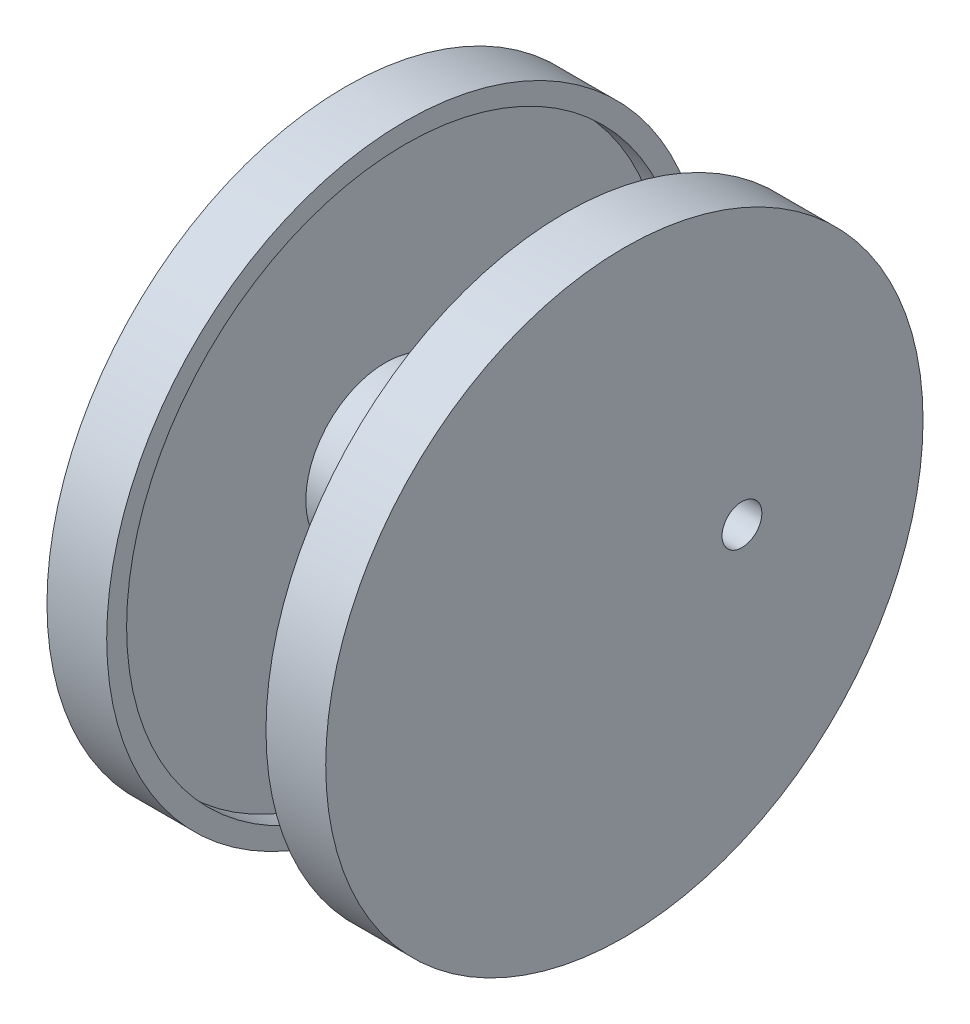
from build123d import *

# Parameters (mm, degrees)
CUT_EXTRUDE1_DEPTH = 5
CIRPATTERN1_COUNT  = 5
SKETCH4_R          = 5
CUT_EXTRUDE4_DEPTH = 16


with BuildPart() as part:
    # Sketch1 → Revolve2 (revolve)
    with BuildSketch(Plane.XY, mode=Mode.PRIVATE) as revolve2_sk:
        Polygon((-52.115384615, 0), (17.884615385, 0), (17.884615385, 75), (2.884615385, 75), (2.884615385, 70), (7.884615385, 70), (7.884615385, 20), (-42.115384615, 20), (-42.115384615, 70), (-37.115384615, 70), (-37.115384615, 75), (-52.115384615, 75), align=None)
    revolve(revolve2_sk.sketch.rotate(Axis((-114.1965821, 0, 0), (1, 0, 0)), 90), axis=Axis((-114.1965821, 0, 0), (1, 0, 0)))

    # Sketch2 → Cut-Extrude1 (cut)
    with BuildSketch(Plane.ZY.offset(52.115384615)):
        with BuildLine():
            Line((-18.889553649, 71.548478411), (-17.514771122, 65.705652668))
            ThreePointArc((-17.514771122, 65.705652668), (0, 68), (17.514771122, 65.705652668))
            Line((17.514771122, 65.705652668), (18.889553649, 71.548478411))
            ThreePointArc((18.889553649, 71.548478411), (0, 74), (-18.889553649, 71.548478411))
        make_face()
    cut_extrude1 = extrude(amount=-CUT_EXTRUDE1_DEPTH, mode=Mode.SUBTRACT)

    # CirPattern1: Cut-Extrude1 ×5 about axis
    cirpattern1_axis = Axis((0, 0, 0), (1, 0, 0))
    for i in range(1, CIRPATTERN1_COUNT):
        add(cut_extrude1.rotate(cirpattern1_axis, i * 360 / CIRPATTERN1_COUNT), mode=Mode.SUBTRACT)

    # Sketch4 → Cut-Extrude4 (cut)
    with BuildSketch(Plane(origin=(17.884615385, 0, 0), x_dir=(0, 0, -1), z_dir=(1, 0, 0))):
        with Locations((29.519700861, 0)):
            Circle(SKETCH4_R)
    extrude(amount=-CUT_EXTRUDE4_DEPTH, mode=Mode.SUBTRACT)


solid = part.part
